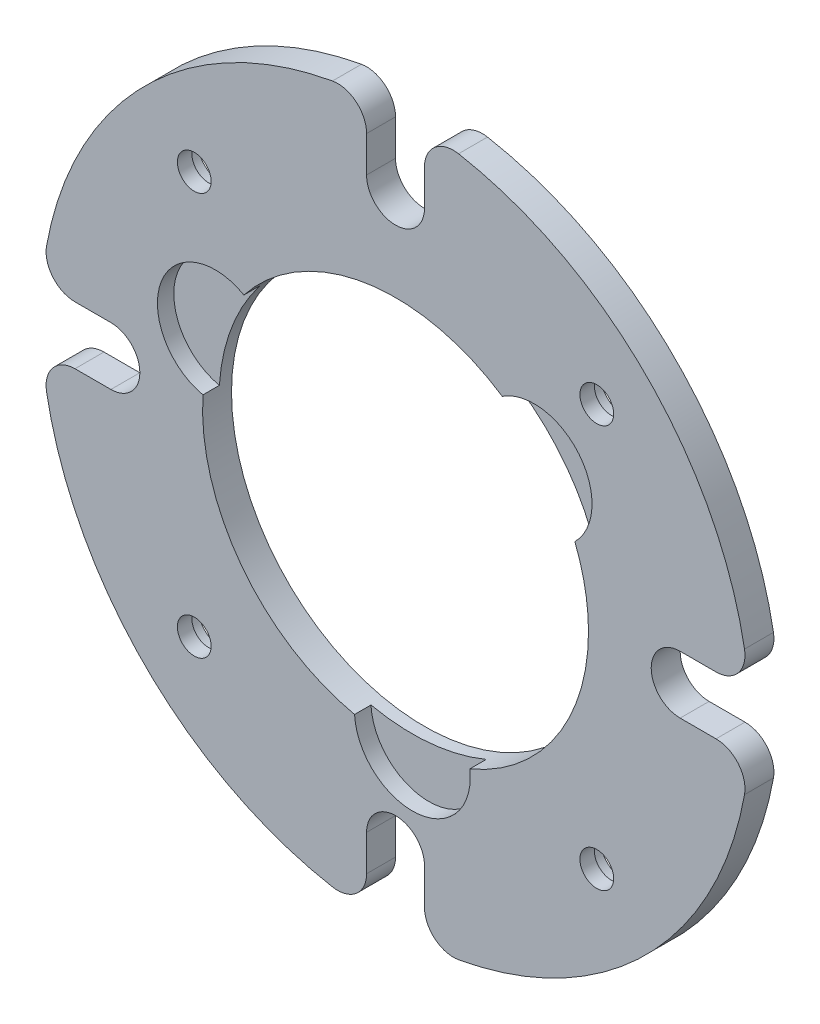
from build123d import *

# Parameters (mm, degrees)
SKETCH5_R                = 36.756756757
SKETCH5_R_2              = 20
BOSS_EXTRUDE1_DEPTH      = 3
SKETCH8_R                = 1.75
CUT_EXTRUDE3_DEPTH       = 5
SKETCH27_R               = 1.75
CUT_EXTRUDE9_DEPTH       = 5
SKETCH28_R               = 1.75
CUT_EXTRUDE10_DEPTH      = 10
FILLET1_R                = 3
CIRPATTERN1_COUNT        = 4
FILLET1_OF_CIRPATTERN1_R = 3
SKETCH32_R               = 6
SKETCH32_R_2             = 20
CUT_EXTRUDE11_DEPTH      = 1.7
SKETCH33_R               = 2.7
CUT_EXTRUDE12_DEPTH      = 1.5


with BuildPart() as part:
    # Sketch5 → Boss-Extrude1 (new body)
    with BuildSketch(Plane.XY):
        Circle(SKETCH5_R)
        Circle(SKETCH5_R_2, mode=Mode.SUBTRACT)
    extrude(amount=-BOSS_EXTRUDE1_DEPTH)

    # Sketch8 → Cut-Extrude3 (cut)
    with BuildSketch(Plane.XY):
        with Locations((20.859650045, 20.859650045)):
            Circle(SKETCH8_R)
        with Locations((-20.859650045, 20.859650045)):
            Circle(SKETCH8_R)
        with Locations((-20.859650045, -20.859650045)):
            Circle(SKETCH8_R)
        with Locations((20.859650045, -20.859650045)):
            Circle(SKETCH8_R)
    extrude(amount=-CUT_EXTRUDE3_DEPTH, mode=Mode.SUBTRACT)

    # Sketch27 → Cut-Extrude9 (cut)
    with BuildSketch(Plane.XY):
        with Locations((0, 29.5)):
            Circle(SKETCH27_R)
        with Locations((29.5, 0)):
            Circle(SKETCH27_R)
        with Locations((0, -29.5)):
            Circle(SKETCH27_R)
        with Locations((-29.5, 0)):
            Circle(SKETCH27_R)
    extrude(amount=-CUT_EXTRUDE9_DEPTH, mode=Mode.SUBTRACT)

    # Sketch28 → Cut-Extrude10 (cut)
    with BuildSketch(Plane.XY):
        with BuildLine():
            Line((-3, 36.63412572), (-3, 29.5))
            ThreePointArc((-3, 29.5), (0, 26.5), (3, 29.5))
            Line((3, 29.5), (3, 36.63412572))
            ThreePointArc((3, 36.63412572), (0, 36.756756757), (-3, 36.63412572))
        make_face()
        with Locations((0, 29.5)):
            Circle(SKETCH28_R, mode=Mode.SUBTRACT)
    cut_extrude10 = extrude(amount=-CUT_EXTRUDE10_DEPTH, mode=Mode.SUBTRACT)

    # Fillet1
    fillet1_edges = [part.edges().sort_by_distance(p)[0] for p in [
        (-3, 36.63412572, -1.5),
        (3, 36.63412572, -1.5),
    ]]
    fillet(fillet1_edges, radius=FILLET1_R)

    # CirPattern1: Cut-Extrude10 ×4 about axis
    cirpattern1_axis = Axis((0, 0, 0), (0, 0, 1))
    for i in range(1, CIRPATTERN1_COUNT):
        add(cut_extrude10.rotate(cirpattern1_axis, i * 360 / CIRPATTERN1_COUNT), mode=Mode.SUBTRACT)

    # Fillet1 of CirPattern1
    fillet1_of_cirpattern1_edges = [part.edges().sort_by_distance(p)[0] for p in [
        (-36.63412572, -3, -1.5),
        (-36.63412572, 3, -1.5),
        (3, -36.63412572, -1.5),
        (-3, -36.63412572, -1.5),
        (36.63412572, 3, -1.5),
        (36.63412572, -3, -1.5),
    ]]
    fillet(fillet1_of_cirpattern1_edges, radius=FILLET1_OF_CIRPATTERN1_R)

    # Sketch32 → Cut-Extrude11 (cut)
    with BuildSketch(Plane.XY):
        with Locations((-18.677893379, 7.150964894)):
            Circle(SKETCH32_R)
        Circle(SKETCH32_R_2)
        with Locations((14.366974153, 11.655044131)):
            Circle(SKETCH32_R)
        with Locations((1.745187427, -19.214690235)):
            Circle(SKETCH32_R)
    extrude(amount=-CUT_EXTRUDE11_DEPTH, mode=Mode.SUBTRACT)

    # Sketch33 → Cut-Extrude12 (cut)
    with BuildSketch(Plane(origin=(0, 0, -3), x_dir=(-1, 0, 0), z_dir=(0, 0, -1))):
        with Locations((-20.859650045, 20.859650045)):
            Circle(SKETCH33_R)
        with Locations((20.859650045, 20.859650045)):
            Circle(SKETCH33_R)
        with Locations((20.859650045, -20.859650045)):
            Circle(SKETCH33_R)
        with Locations((-20.859650045, -20.859650045)):
            Circle(SKETCH33_R)
    extrude(amount=-CUT_EXTRUDE12_DEPTH, mode=Mode.SUBTRACT)


solid = part.part
